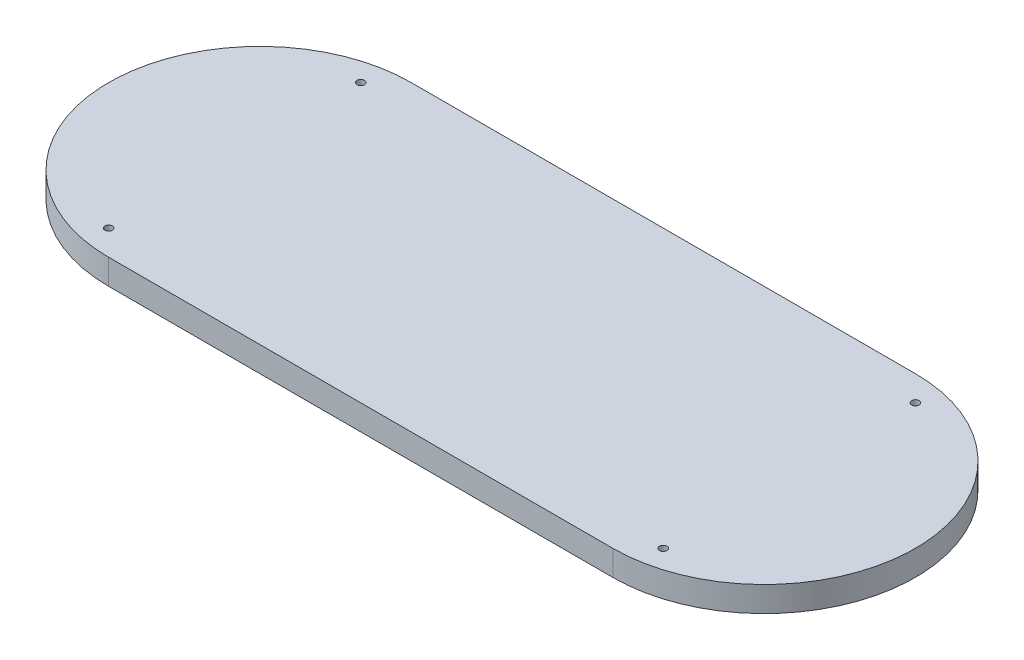
from build123d import *

# Parameters (mm, degrees)
BOSS_EXTRUDE1_DEPTH = 10
SKETCH2_R           = 1.5
CUT_EXTRUDE1_DEPTH  = 172.172427686


with BuildPart() as part:
    # Sketch1 → Boss-Extrude1 (new body)
    with BuildSketch(Plane(origin=(0, 0, 0), x_dir=(1, 0, 0), z_dir=(0, 1, 0))):
        with BuildLine():
            Line((-100, 60), (100, 60))
            ThreePointArc((100, 60), (160, 0), (100, -60))
            Line((100, -60), (-100, -60))
            ThreePointArc((-100, -60), (-160, 0), (-100, 60))
        make_face()
    extrude(amount=BOSS_EXTRUDE1_DEPTH)

    # Sketch2 → Cut-Extrude1 (cut, through all)
    with BuildSketch(Plane(origin=(0, 10, 0), x_dir=(1, 0, 0), z_dir=(0, 1, 0))):
        with Locations(Location((-110, 50, 0), (0, 0, 270))):
            Circle(SKETCH2_R)
        with Locations(Location((-110, -50, 0), (0, 0, 270))):
            Circle(SKETCH2_R)
        with Locations(Location((110, -50, 0), (0, 0, 270))):
            Circle(SKETCH2_R)
        with Locations(Location((110, 50, 0), (0, 0, 270))):
            Circle(SKETCH2_R)
    extrude(amount=-CUT_EXTRUDE1_DEPTH, mode=Mode.SUBTRACT)


solid = part.part
